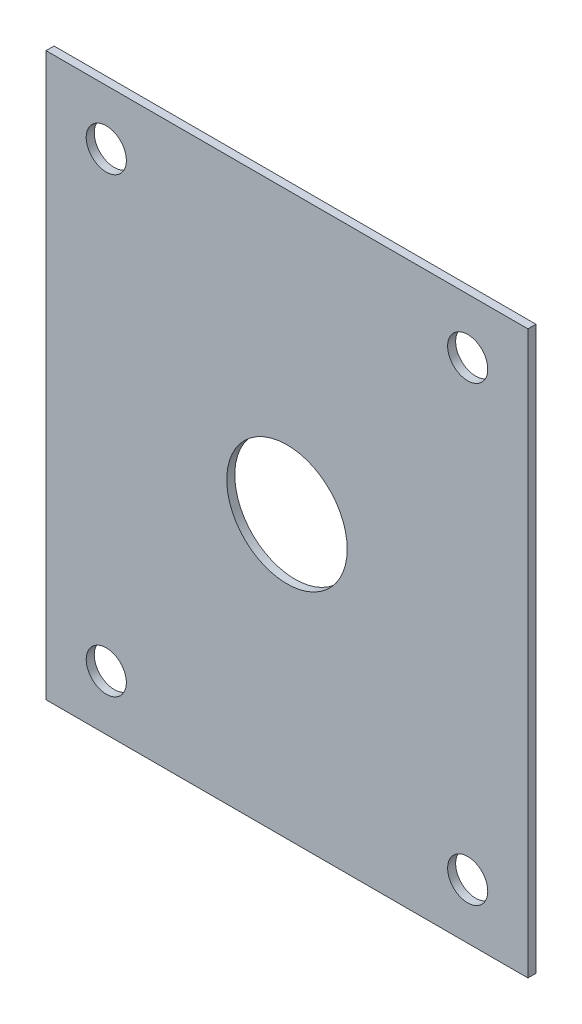
from build123d import *

# Parameters (mm, degrees)
SKETCH1_W           = 152.4
SKETCH1_H           = 177.8
BOSS_EXTRUDE1_DEPTH = 2.54
SKETCH2_R           = 19.05
CUT_EXTRUDE1_DEPTH  = 235.190203894
SKETCH3_R           = 6.35
CUT_EXTRUDE3_DEPTH  = 235.190203894


with BuildPart() as part:
    # Sketch1 → Boss-Extrude1 (new body)
    with BuildSketch(Plane.XY):
        with Locations((76.2, 88.9)):
            Rectangle(SKETCH1_W, SKETCH1_H)
    extrude(amount=BOSS_EXTRUDE1_DEPTH)

    # Sketch2 → Cut-Extrude1 (cut, through all)
    with BuildSketch(Plane.XY):
        with Locations((76.2, 88.9)):
            Circle(SKETCH2_R)
    extrude(amount=CUT_EXTRUDE1_DEPTH, mode=Mode.SUBTRACT)

    # Sketch3 → Cut-Extrude3 (cut, through all)
    with BuildSketch(Plane.XY):
        with Locations((19.05, 160.401)):
            Circle(SKETCH3_R)
        with Locations(Location((133.35, 160.401, 0), (0, 0, 180))):
            Circle(SKETCH3_R)
        with Locations((133.35, 17.399)):
            Circle(SKETCH3_R)
        with Locations(Location((19.05, 17.399, 0), (0, 0, 180))):
            Circle(SKETCH3_R)
    extrude(amount=CUT_EXTRUDE3_DEPTH, mode=Mode.SUBTRACT)


solid = part.part
